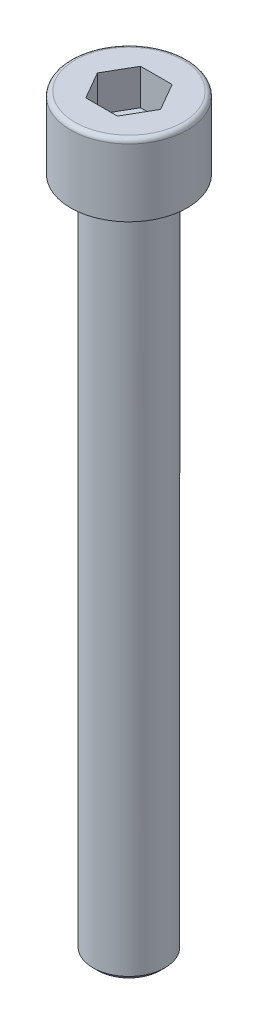
from build123d import *

# Parameters (mm, degrees)
SKETCH_1_R          = 6.5
EXTRUDE_1_DEPTH     = 8
CUT_EXTRUDE_1_DEPTH = 4
FILLET_1_R          = 0.5
SKETCH_3_R          = 4
EXTRUDE_2_DEPTH     = 75
FILLET_2_R          = 0.5
CHAMFER_1_SIZE      = 0.5


with BuildPart() as part:
    # ｽｹｯﾁ1 → ﾎﾞｽ - 押し出し1 (new body)
    with BuildSketch(Plane(origin=(0, 0, 0), x_dir=(1, 0, 0), z_dir=(0, 1, 0))):
        with Locations(Location((0, 0, 0), (0, 0, 270))):
            Circle(SKETCH_1_R)
    extrude(amount=EXTRUDE_1_DEPTH)

    # ｽｹｯﾁ2 → ｶｯﾄ - 押し出し1 (cut)
    with BuildSketch(Plane(origin=(0, 8, 0), x_dir=(1, 0, 0), z_dir=(0, 1, 0))):
        Polygon((3.516063139, 0), (1.75803157, 3.045), (-1.75803157, 3.045), (-3.516063139, 0), (-1.75803157, -3.045), (1.75803157, -3.045), align=None)
    extrude(amount=-CUT_EXTRUDE_1_DEPTH, mode=Mode.SUBTRACT)

    # ﾌｨﾚｯﾄ1
    fillet_1_edges = [part.edges().sort_by_distance(p)[0] for p in [
        (0, 8, -6.5),
    ]]
    fillet(fillet_1_edges, radius=FILLET_1_R)

    # ｽｹｯﾁ3 → ﾎﾞｽ - 押し出し2 (add)
    with BuildSketch(Plane.XZ):
        with Locations(Location((0, 0, 0), (0, 0, 90))):
            Circle(SKETCH_3_R)
    extrude(amount=EXTRUDE_2_DEPTH)

    # ﾌｨﾚｯﾄ2
    fillet_2_edges = [part.edges().sort_by_distance(p)[0] for p in [
        (0, 0, -4),
    ]]
    fillet(fillet_2_edges, radius=FILLET_2_R)

    # 面取り1
    chamfer_1_edges = [part.edges().sort_by_distance(p)[0] for p in [
        (0, -75, -4),
    ]]
    chamfer(chamfer_1_edges, length=CHAMFER_1_SIZE)


solid = part.part
